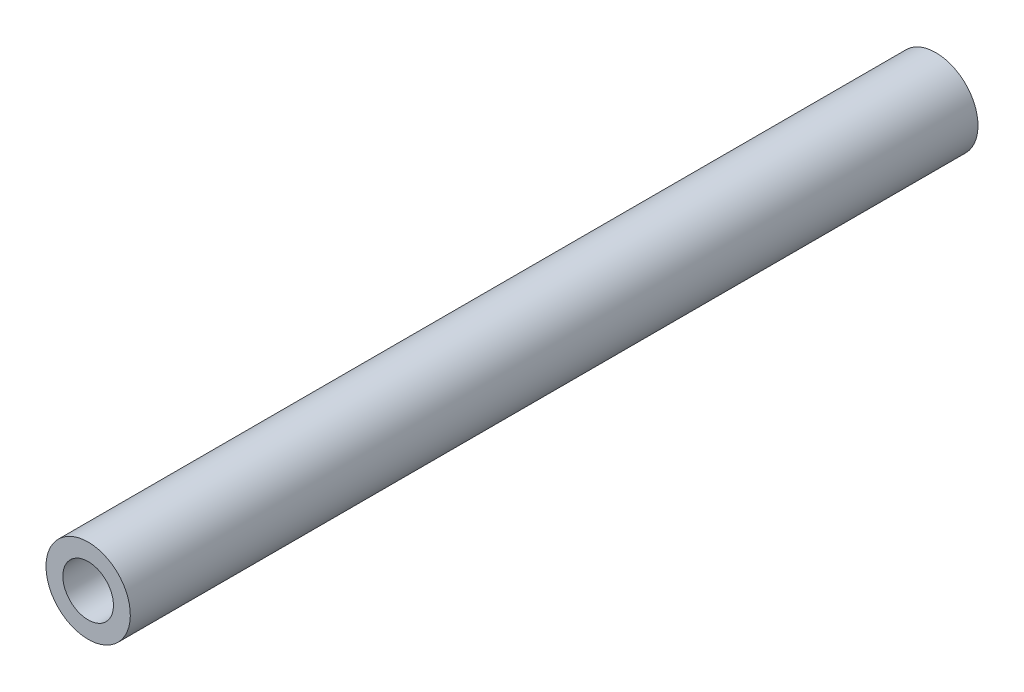
from build123d import *

# Parameters (mm, degrees)
SKETCH1_W = 1005
SKETCH1_H = 20


with BuildPart() as part:
    # Sketch1 → Revolve1 (revolve)
    with BuildSketch(Plane(origin=(0, 0, 0), x_dir=(0, 0, -1), z_dir=(1, 0, 0))):
        with Locations((-502.5, 40)):
            Rectangle(SKETCH1_W, SKETCH1_H)
    revolve(axis=Axis((0, 0, -30.052173913), (0, 0, 1)))


solid = part.part
